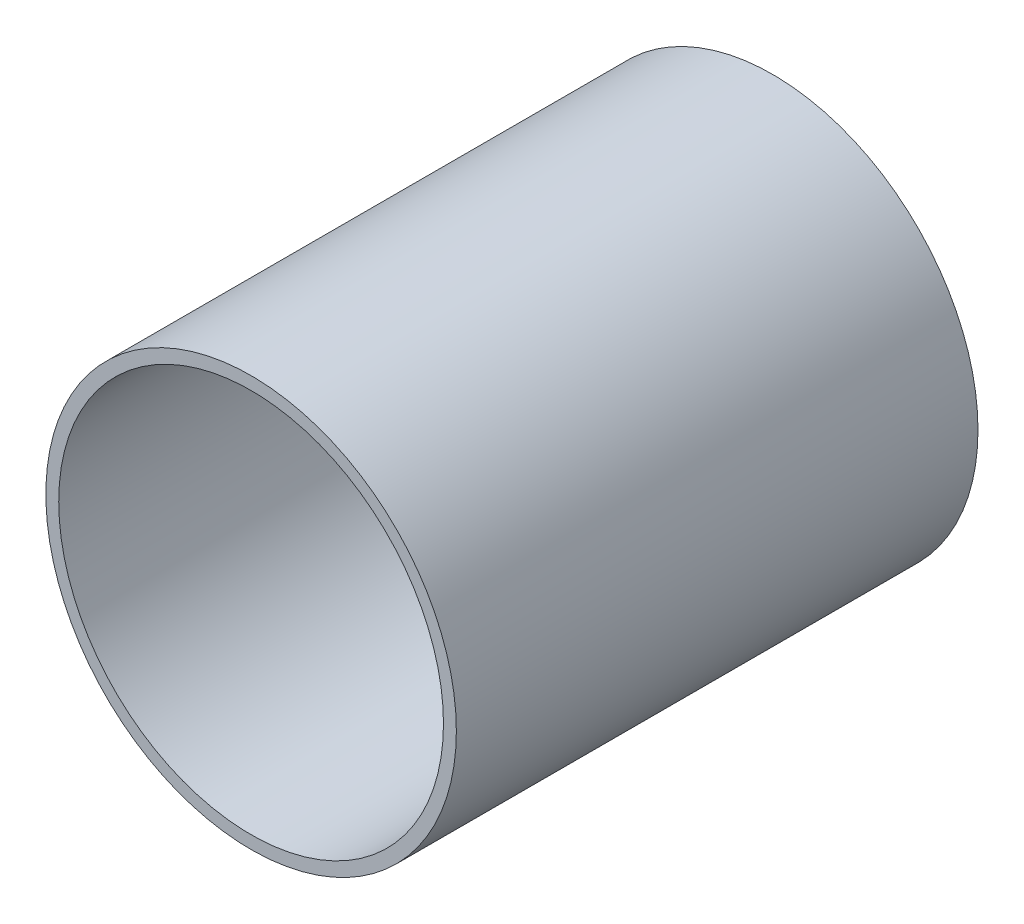
from build123d import *

# Parameters (mm, degrees)
CROQUIS1_R              = 31.88
SALIENTE_EXTRUIR1_DEPTH = 40.51
CROQUIS2_R              = 29.88
CORTAR_EXTRUIR1_DEPTH   = 81.02


with BuildPart() as part:
    # Croquis1 → Saliente-Extruir1 (new, symmetric)
    with BuildSketch(Plane.XY):
        Circle(CROQUIS1_R)
    extrude(amount=SALIENTE_EXTRUIR1_DEPTH, both=True)

    # Croquis2 → Cortar-Extruir1 (cut)
    with BuildSketch(Plane(origin=(0, 0, -40.51), x_dir=(-1, 0, 0), z_dir=(0, 0, -1))):
        Circle(CROQUIS2_R)
    extrude(amount=-CORTAR_EXTRUIR1_DEPTH, mode=Mode.SUBTRACT)


solid = part.part
